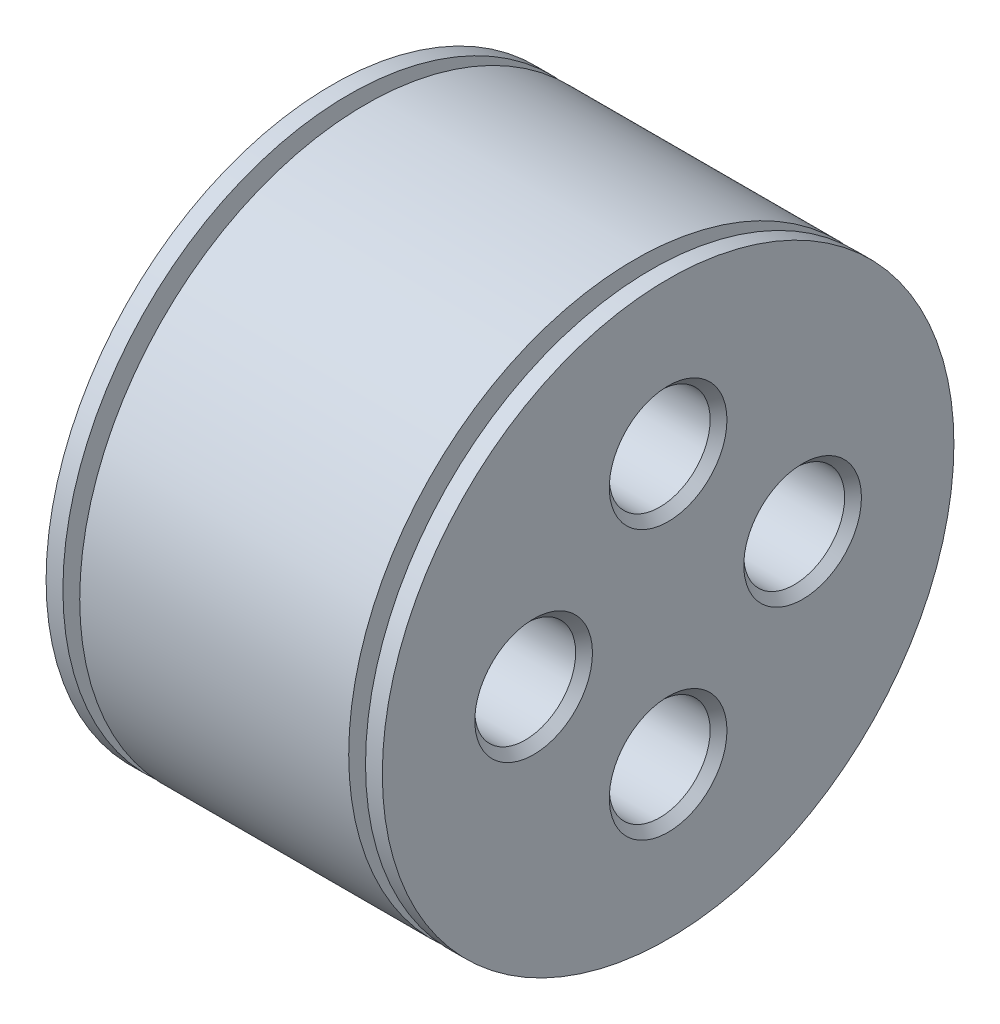
from build123d import *

# Parameters (mm, degrees)
SKETCH1_R           = 17
BOSS_EXTRUDE1_DEPTH = 1
SKETCH2_R           = 15
BOSS_EXTRUDE2_DEPTH = 1
SKETCH4_R           = 17
BOSS_EXTRUDE3_DEPTH = 16
SKETCH5_R           = 13
BOSS_EXTRUDE4_DEPTH = 1
SKETCH6_R           = 17
BOSS_EXTRUDE5_DEPTH = 1
SKETCH7_R           = 11
CUT_EXTRUDE1_DEPTH  = 6
SKETCH8_R           = 1.5
CUT_EXTRUDE2_DEPTH  = 14
SKETCH9_R           = 3
CUT_EXTRUDE3_DEPTH  = 5
CHAMFER1_SIZE       = 0.5


with BuildPart() as part:
    # Sketch1 → Boss-Extrude1 (new body)
    with BuildSketch(Plane(origin=(0, 0, 0), x_dir=(0, 0, -1), z_dir=(1, 0, 0))):
        Circle(SKETCH1_R)
    extrude(amount=BOSS_EXTRUDE1_DEPTH)

    # Sketch2 → Boss-Extrude2 (add)
    with BuildSketch(Plane(origin=(1, 0, 0), x_dir=(0, 0, -1), z_dir=(1, 0, 0))):
        Circle(SKETCH2_R)
    extrude(amount=BOSS_EXTRUDE2_DEPTH)

    # Sketch4 → Boss-Extrude3 (add)
    with BuildSketch(Plane(origin=(2, 0, 0), x_dir=(0, 0, -1), z_dir=(1, 0, 0))):
        Circle(SKETCH4_R)
    extrude(amount=BOSS_EXTRUDE3_DEPTH)

    # Sketch5 → Boss-Extrude4 (add)
    with BuildSketch(Plane(origin=(18, 0, 0), x_dir=(0, 0, -1), z_dir=(1, 0, 0))):
        Circle(SKETCH5_R)
    extrude(amount=BOSS_EXTRUDE4_DEPTH)

    # Sketch6 → Boss-Extrude5 (add)
    with BuildSketch(Plane(origin=(19, 0, 0), x_dir=(0, 0, -1), z_dir=(1, 0, 0))):
        Circle(SKETCH6_R)
    extrude(amount=BOSS_EXTRUDE5_DEPTH)

    # Sketch7 → Cut-Extrude1 (cut)
    with BuildSketch(Plane.ZY):
        Circle(SKETCH7_R)
    extrude(amount=-CUT_EXTRUDE1_DEPTH, mode=Mode.SUBTRACT)

    # Sketch8 → Cut-Extrude2 (cut)
    with BuildSketch(Plane.ZY.offset(-6)):
        with Locations((0, 8)):
            Circle(SKETCH8_R)
        with Locations((8, 0)):
            Circle(SKETCH8_R)
        with Locations((0, -8)):
            Circle(SKETCH8_R)
        with Locations((-8, 0)):
            Circle(SKETCH8_R)
    extrude(amount=-CUT_EXTRUDE2_DEPTH, mode=Mode.SUBTRACT)

    # Sketch9 → Cut-Extrude3 (cut)
    with BuildSketch(Plane(origin=(20, 0, 0), x_dir=(0, 0, -1), z_dir=(1, 0, 0))):
        with Locations((-8, 0)):
            Circle(SKETCH9_R)
        with Locations((0, 8)):
            Circle(SKETCH9_R)
        with Locations((8, 0)):
            Circle(SKETCH9_R)
        with Locations((0, -8)):
            Circle(SKETCH9_R)
    extrude(amount=-CUT_EXTRUDE3_DEPTH, mode=Mode.SUBTRACT)

    # Chamfer1
    chamfer1_edges = [part.edges().sort_by_distance(p)[0] for p in [
        (20, 0, 11),
        (20, 8, 3),
        (20, 0, -5),
        (20, -8, 3),
    ]]
    chamfer(chamfer1_edges, length=CHAMFER1_SIZE)


solid = part.part
